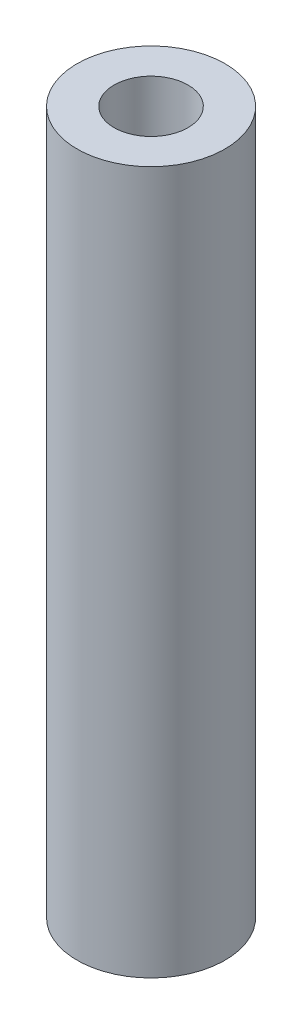
from build123d import *

# Parameters (mm, degrees)
SKETCH1_R           = 5.08
SKETCH1_R_2         = 2.54
BOSS_EXTRUDE1_DEPTH = 48.26


with BuildPart() as part:
    # Sketch1 → Boss-Extrude1 (new body)
    with BuildSketch(Plane(origin=(0, 0, 0), x_dir=(1, 0, 0), z_dir=(0, 1, 0))):
        with Locations(Location((0, 0, 0), (0, 0, 90))):
            Circle(SKETCH1_R)
        with Locations(Location((0, 0, 0), (0, 0, 90))):
            Circle(SKETCH1_R_2, mode=Mode.SUBTRACT)
    extrude(amount=BOSS_EXTRUDE1_DEPTH)


solid = part.part
